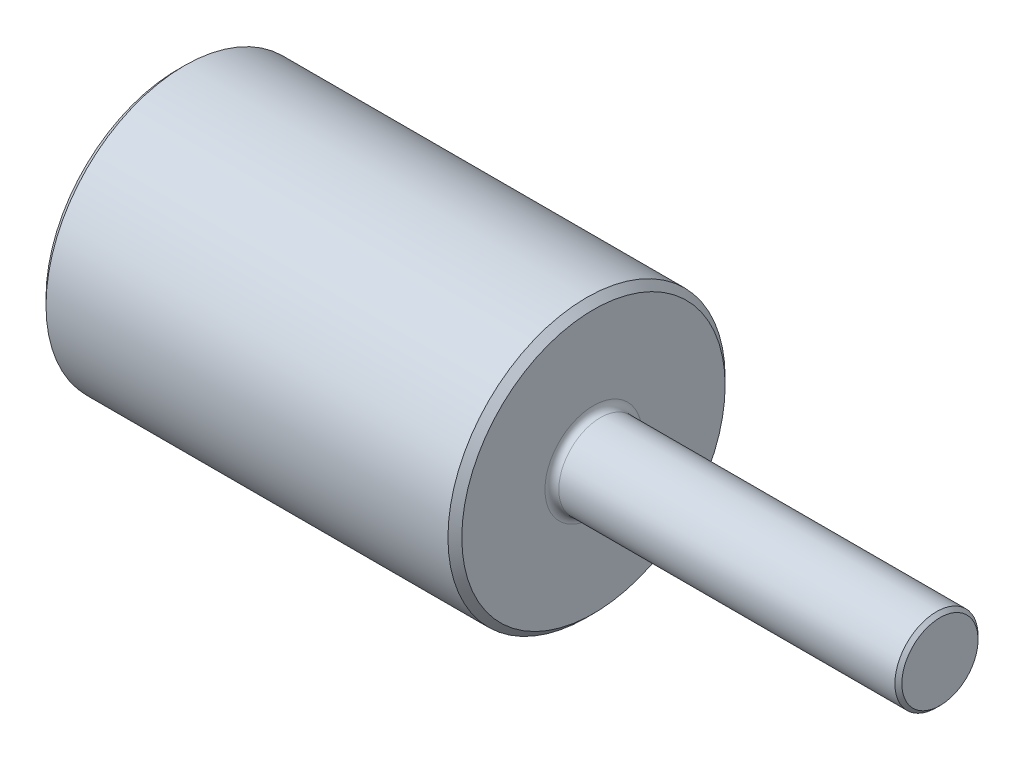
from build123d import *

# Parameters (mm, degrees)
CHANFREIN1_SIZE = 0.25
CHANFREIN3_SIZE = 0.5
CONG_1_R        = 0.5


with BuildPart() as part:
    # Esquisse1 → Base-Révolution (revolve)
    with BuildSketch(Plane.XY, mode=Mode.PRIVATE) as base_r_volution_sk:
        Polygon((0, 0), (0, 3), (-25, 3), (-25, 10), (-55, 10), (-55, 0), align=None)
    revolve(base_r_volution_sk.sketch.rotate(Axis((-58.669915368, 0, 0), (1, 0, 0)), 90), axis=Axis((-58.669915368, 0, 0), (1, 0, 0)))

    # Chanfrein1
    chanfrein1_edges = [part.edges().sort_by_distance(p)[0] for p in [
        (0, 0, -3),
    ]]
    chamfer(chanfrein1_edges, length=CHANFREIN1_SIZE)

    # Chanfrein3
    chanfrein3_edges = [part.edges().sort_by_distance(p)[0] for p in [
        (-55, 0, -10),
        (-25, 0, -10),
    ]]
    chamfer(chanfrein3_edges, length=CHANFREIN3_SIZE)

    # Congé1
    cong_1_edges = [part.edges().sort_by_distance(p)[0] for p in [
        (-25, 0, -3),
    ]]
    fillet(cong_1_edges, radius=CONG_1_R)


solid = part.part
